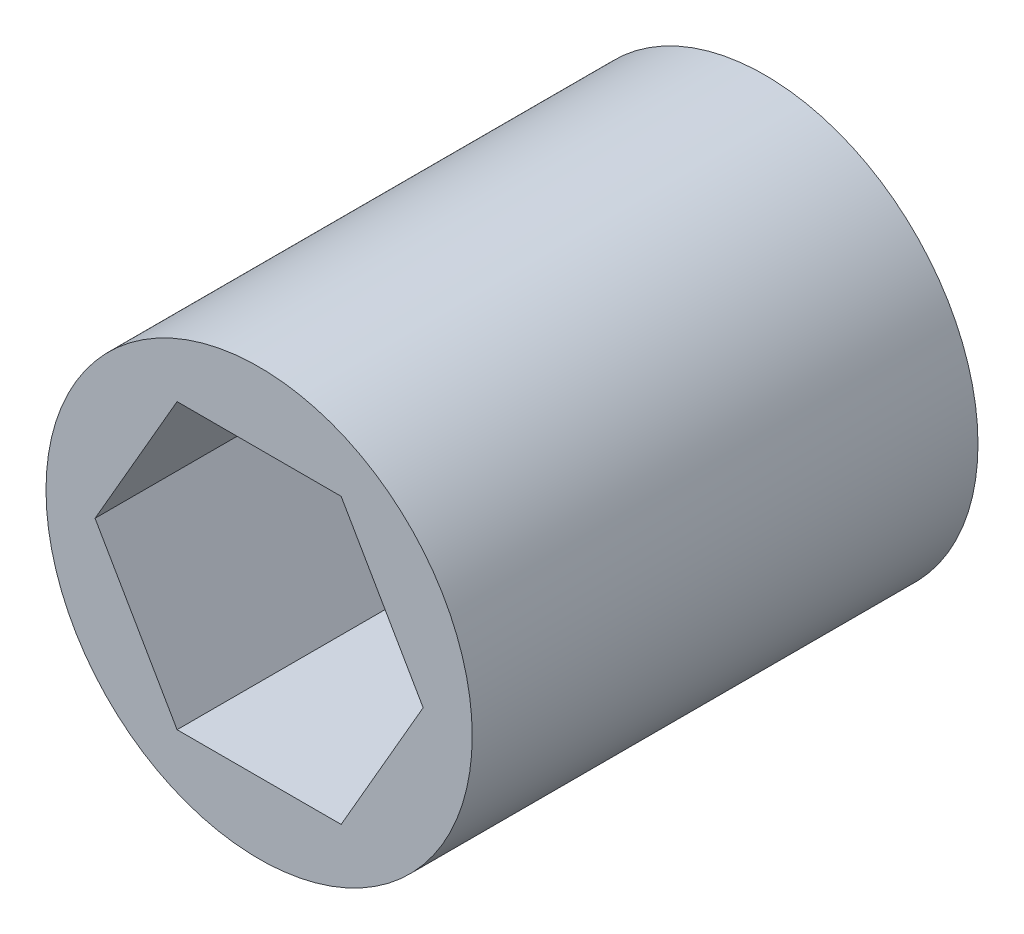
from build123d import *

# Parameters (mm, degrees)
SKETCH1_R           = 9.525
BOSS_EXTRUDE1_DEPTH = 22.606


with BuildPart() as part:
    # Sketch1 → Boss-Extrude1 (new body)
    with BuildSketch(Plane.XY):
        with Locations(Location((0, 0, 0), (0, 0, 180))):
            Circle(SKETCH1_R)
        Polygon((3.666174209, 6.35), (-3.666174209, 6.35), (-7.332348419, 0), (-3.666174209, -6.35), (3.666174209, -6.35), (7.332348419, 0), align=None, mode=Mode.SUBTRACT)
    extrude(amount=BOSS_EXTRUDE1_DEPTH)


solid = part.part
